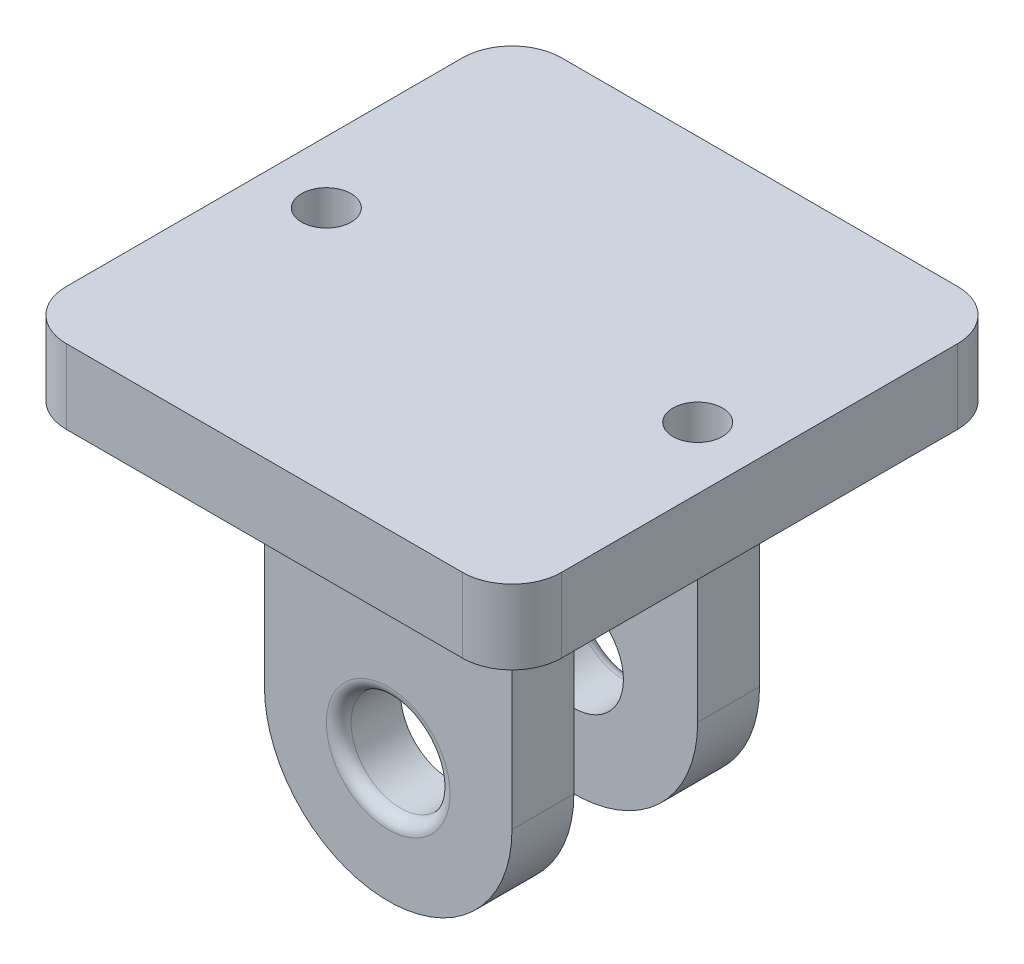
from build123d import *

# Parameters (mm, degrees)
ESQUISSE1_W             = 10
ESQUISSE1_H             = 15
BOSS_EXTRU_1_DEPTH      = 10
CONG_1_RADIUS           = 5
CONG_1_LENGTH           = 10
ESQUISSE3_W             = 5
ESQUISSE3_H             = 12
ENL_V_MAT_EXTRU_1_DEPTH = 10
ESQUISSE4_W             = 10
ESQUISSE4_H             = 10
BOSS_EXTRU_2_DEPTH      = 3
ESQUISSE5_R             = 1
ENL_V_MAT_EXTRU_2_DEPTH = 3
ESQUISSE6_R             = 2
ENL_V_MAT_EXTRU_3_DEPTH = 21.862646045
CONG_2_R                = 0.5
CONG_3_R                = 0.5


with BuildPart() as part:
    # Esquisse1 → Boss.-Extru.1 (new body)
    with BuildSketch(Plane.XY):
        Rectangle(ESQUISSE1_W, ESQUISSE1_H)
    extrude(amount=BOSS_EXTRU_1_DEPTH)

    # Congé1: full round fillet: the end face becomes a half cylinder, R = half its width
    cong_1_face = Plane((0, -7.5, 5), x_dir=(0, 0, 1), z_dir=(0, -1, 0))  # on the end face: x along it, z out of the body
    cong_1_slab = cong_1_face.offset(-CONG_1_RADIUS / 2) * Box(CONG_1_LENGTH, 2 * CONG_1_RADIUS, CONG_1_RADIUS, mode=Mode.PRIVATE)  # the body's end, R deep
    cong_1_round = Plane((0, -2.5, 5), x_dir=(0, -1, 0), z_dir=(0, 0, 1)) * Cylinder(CONG_1_RADIUS, CONG_1_LENGTH, mode=Mode.PRIVATE)  # its axis R under the face
    add(cong_1_slab - cong_1_round, mode=Mode.SUBTRACT)

    # Esquisse3 → Enlèv. mat.-Extru.1 (cut)
    with BuildSketch(Plane.ZY.offset(5)):
        with Locations((5, -1.5)):
            Rectangle(ESQUISSE3_W, ESQUISSE3_H)
    extrude(amount=-ENL_V_MAT_EXTRU_1_DEPTH, mode=Mode.SUBTRACT)

    # Esquisse4 → Boss.-Extru.2 (add)
    # profile 1 of 2: a face of its own
    with BuildSketch(Plane(origin=(0, 7.5, 0), x_dir=(1, 0, 0), z_dir=(0, 1, 0))):
        with BuildLine():
            Line((8, 5), (-8, 5))
            ThreePointArc((-8, 5), (-9.414213562, 4.414213562), (-10, 3))
            Line((-10, 3), (-10, -13))
            ThreePointArc((-10, -13), (-9.414213562, -14.414213562), (-8, -15))
            Line((-8, -15), (8, -15))
            ThreePointArc((8, -15), (9.414213562, -14.414213562), (10, -13))
            Line((10, -13), (10, 3))
            ThreePointArc((10, 3), (9.414213562, 4.414213562), (8, 5))
        make_face()
        with Locations((0, -5)):
            Rectangle(ESQUISSE4_W, ESQUISSE4_H, mode=Mode.SUBTRACT)
    # profile 2 of 2: a face of its own
    with BuildSketch(Plane(origin=(0, 7.5, 0), x_dir=(1, 0, 0), z_dir=(0, 1, 0))):
        with Locations((0, -5)):
            Rectangle(ESQUISSE4_W, ESQUISSE4_H)
    extrude(amount=BOSS_EXTRU_2_DEPTH)

    # Esquisse5 → Enlèv. mat.-Extru.2 (cut)
    with BuildSketch(Plane.XZ.offset(-7.5)):
        with Locations(Location((-7.5, 5, 0), (0, 0, 270))):
            Circle(ESQUISSE5_R)
        with Locations(Location((7.5, 5, 0), (0, 0, 270))):
            Circle(ESQUISSE5_R)
    extrude(amount=-ENL_V_MAT_EXTRU_2_DEPTH, mode=Mode.SUBTRACT)

    # Esquisse6 → Enlèv. mat.-Extru.3 (cut, through all)
    with BuildSketch(Plane.XY.offset(10)):
        with Locations((0, -2.5)):
            Circle(ESQUISSE6_R)
    extrude(amount=-ENL_V_MAT_EXTRU_3_DEPTH, mode=Mode.SUBTRACT)

    # Congé2
    cong_2_edges = [part.edges().sort_by_distance(p)[0] for p in [
        (-2, -2.5, 0),
        (-2, -2.5, 10),
    ]]
    fillet(cong_2_edges, radius=CONG_2_R)

    # Congé3
    cong_3_edges = [part.edges().sort_by_distance(p)[0] for p in [
        (0, 7.5, 0),
        (-5, 7.5, 5),
        (5, 7.5, 5),
        (0, 7.5, 10),
    ]]
    fillet(cong_3_edges, radius=CONG_3_R)


solid = part.part
